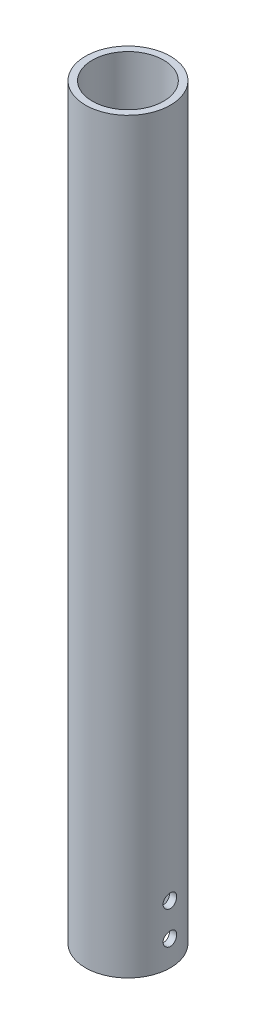
from build123d import *

# Parameters (mm, degrees)
SKETCH_1_R          = 12.5
SKETCH_1_R_2        = 10.5
EXTRUDE_1_DEPTH     = 220
SKETCH_4_R          = 2
CUT_EXTRUDE_1_DEPTH = 100


with BuildPart() as part:
    # Эскиз1 → Вытянуть1 (new body)
    with BuildSketch(Plane(origin=(0, 0, 0), x_dir=(1, 0, 0), z_dir=(0, 1, 0))):
        with Locations(Location((0, 0, 0), (0, 0, 270))):
            Circle(SKETCH_1_R)
        with Locations(Location((0, 0, 0), (0, 0, 270))):
            Circle(SKETCH_1_R_2, mode=Mode.SUBTRACT)
    extrude(amount=EXTRUDE_1_DEPTH)

    # Эскиз4 → Вырез-Вытянуть1 (cut, symmetric)
    with BuildSketch(Plane(origin=(0, 0, 0), x_dir=(0, 0, -1), z_dir=(1, 0, 0))):
        with Locations((0, 17.141022055)):
            Circle(SKETCH_4_R)
        with Locations((0, 7.474896081)):
            Circle(SKETCH_4_R)
    extrude(amount=CUT_EXTRUDE_1_DEPTH, both=True, mode=Mode.SUBTRACT)


solid = part.part
